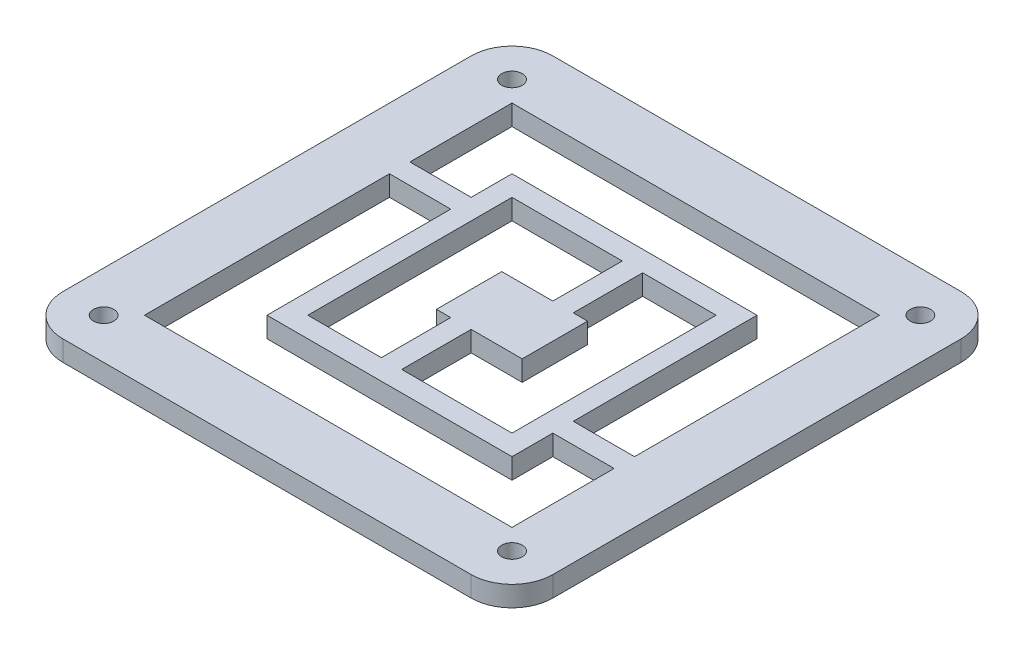
from build123d import *

# Parameters (mm, degrees)
SKETCH1_R             = 2.5
SKETCH1_W             = 90
SKETCH1_H             = 90
BOSS_EXTRUDE1_DEPTH   = 5
SKETCH1_W_2           = 60
SKETCH1_H_2           = 60
SKETCH1_W_3           = 50
SKETCH1_H_3           = 50
BOSS_EXTRUDE1_2_DEPTH = 5
SKETCH1_W_4           = 21
SKETCH1_H_4           = 16
BOSS_EXTRUDE1_3_DEPTH = 5
SKETCH2_W             = 5
SKETCH2_H             = 17
SKETCH2_W_2           = 15
SKETCH2_H_2           = 5
BOSS_EXTRUDE2_DEPTH   = 5


with BuildPart() as part:
    # Sketch1 → Boss-Extrude1 (new body)
    with BuildSketch(Plane(origin=(0, 0, 0), x_dir=(1, 0, 0), z_dir=(0, 1, 0))):
        with BuildLine():
            ThreePointArc((-60, 50), (-57.071067812, 57.071067812), (-50, 60))
            Line((-50, 60), (50, 60))
            ThreePointArc((50, 60), (57.071067812, 57.071067812), (60, 50))
            Line((60, 50), (60, -50))
            ThreePointArc((60, -50), (57.071067812, -57.071067812), (50, -60))
            Line((50, -60), (-50, -60))
            ThreePointArc((-50, -60), (-57.071067812, -57.071067812), (-60, -50))
            Line((-60, -50), (-60, 50))
        make_face()
        with Locations(Location((-50, -50, 0), (0, 0, 270))):
            Circle(SKETCH1_R, mode=Mode.SUBTRACT)
        with Locations(Location((50, -50, 0), (0, 0, 270))):
            Circle(SKETCH1_R, mode=Mode.SUBTRACT)
        with Locations(Location((50, 50, 0), (0, 0, 270))):
            Circle(SKETCH1_R, mode=Mode.SUBTRACT)
        with Locations(Location((-50, 50, 0), (0, 0, 270))):
            Circle(SKETCH1_R, mode=Mode.SUBTRACT)
        Rectangle(SKETCH1_W, SKETCH1_H, mode=Mode.SUBTRACT)
    extrude(amount=BOSS_EXTRUDE1_DEPTH)



with BuildPart() as body_2:
    # Sketch1 → Boss-Extrude1 2 (new body)
    with BuildSketch(Plane(origin=(0, 0, 0), x_dir=(1, 0, 0), z_dir=(0, 1, 0))):
        Rectangle(SKETCH1_W_2, SKETCH1_H_2)
        Rectangle(SKETCH1_W_3, SKETCH1_H_3, mode=Mode.SUBTRACT)
    extrude(amount=BOSS_EXTRUDE1_2_DEPTH)


with BuildPart() as body_3:
    # Sketch1 → Boss-Extrude1 3 (new body)
    with BuildSketch(Plane(origin=(0, 0, 0), x_dir=(1, 0, 0), z_dir=(0, 1, 0))):
        Rectangle(SKETCH1_W_4, SKETCH1_H_4)
    extrude(amount=BOSS_EXTRUDE1_3_DEPTH)


with BuildPart() as part_1:
    add(part.part)

    add(body_2.part)  # Boss-Extrude2 merges body 2

    add(body_3.part)  # Boss-Extrude2 merges body 3
    # Sketch2 → Boss-Extrude2 (add)
    with BuildSketch(Plane(origin=(0, 0, 0), x_dir=(1, 0, 0), z_dir=(0, 1, 0))):
        with Locations((-4.5, -16.5)):
            Rectangle(SKETCH2_W, SKETCH2_H)
        with Locations((4.5, 16.5)):
            Rectangle(SKETCH2_W, SKETCH2_H)
        with Locations((-37.5, 17.5)):
            Rectangle(SKETCH2_W_2, SKETCH2_H_2)
        with Locations((37.5, -17.5)):
            Rectangle(SKETCH2_W_2, SKETCH2_H_2)
    extrude(amount=BOSS_EXTRUDE2_DEPTH)


solid = part_1.part
